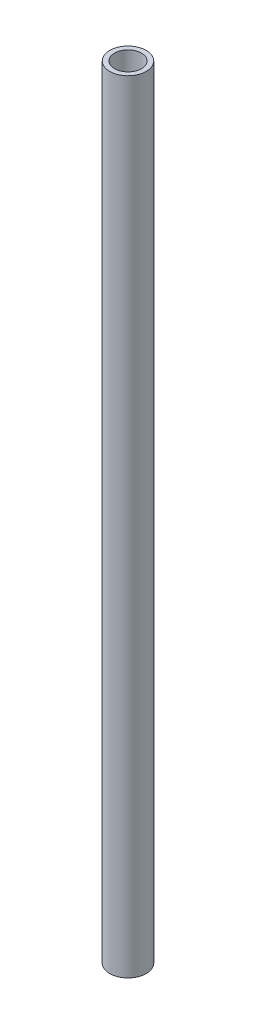
from build123d import *

# Parameters (mm, degrees)
SKETCH1_R           = 10.668
SKETCH1_R_2         = 7.8994
BOSS_EXTRUDE1_DEPTH = 457.2


with BuildPart() as part:
    # Sketch1 → Boss-Extrude1 (new body)
    with BuildSketch(Plane(origin=(0, 0, 0), x_dir=(1, 0, 0), z_dir=(0, 1, 0))):
        with Locations(Location((0, 0, 0), (0, 0, 270))):
            Circle(SKETCH1_R)
        with Locations(Location((0, 0, 0), (0, 0, 270))):
            Circle(SKETCH1_R_2, mode=Mode.SUBTRACT)
    extrude(amount=BOSS_EXTRUDE1_DEPTH)


solid = part.part
